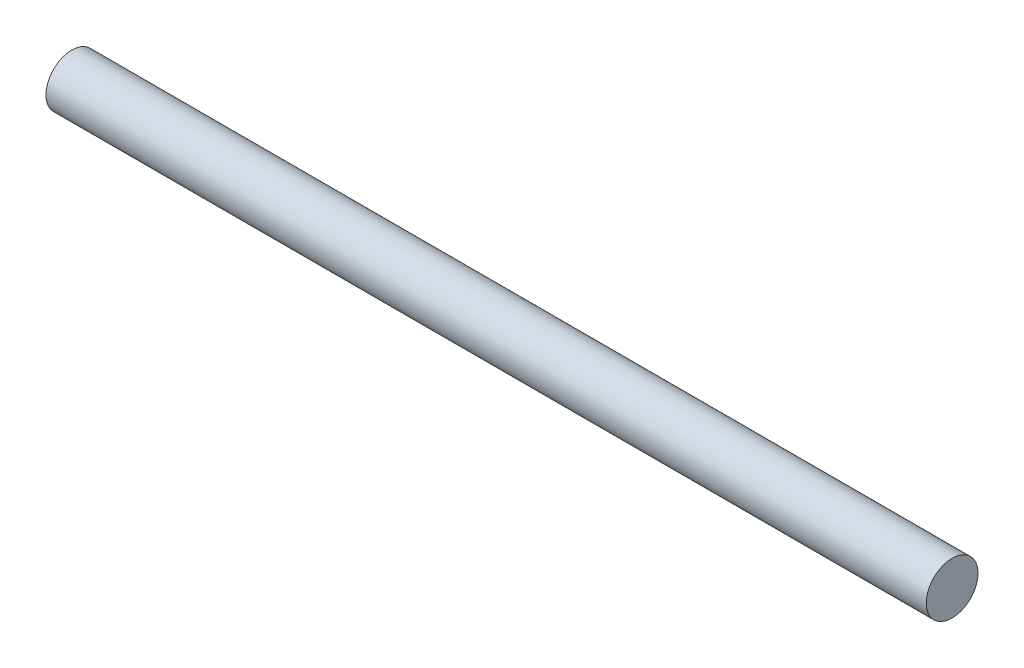
from build123d import *

# Parameters (mm, degrees)
SKETCH1_R           = 3
BOSS_EXTRUDE1_DEPTH = 102


with BuildPart() as part:
    # Sketch1 → Boss-Extrude1 (new body)
    with BuildSketch(Plane(origin=(0, 0, 0), x_dir=(0, 0, -1), z_dir=(1, 0, 0))):
        Circle(SKETCH1_R)
    extrude(amount=BOSS_EXTRUDE1_DEPTH)


solid = part.part
